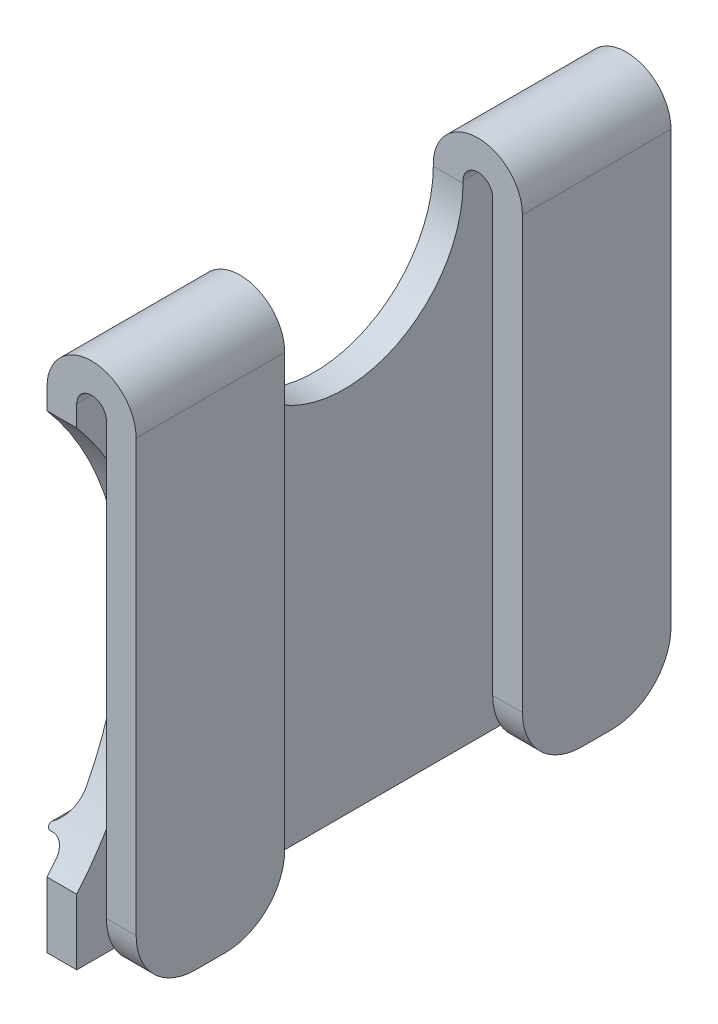
from build123d import *

# Parameters (mm, degrees)
SKETCH_1_W                      = 90
SKETCH_1_H                      = 90
EXTRUDE_1_DEPTH                 = 15
SKETCH_2_W                      = 5
SKETCH_2_H                      = 82.5
CUT_EXTRUDE_1_DEPTH             = 102.734949747
CUT_EXTRUDE_2_REACH             = 67.383
SKETCH_3_W                      = 40
SKETCH_3_H                      = 90
FILLET_1_R                      = 10
CUT_EXTRUDE_3_DEPTH             = 65.420493634
EXTRUDE_4_DEPTH                 = 15
EXTRUDE_4_DEPTH_BACK            = 15
SKETCH_7_R                      = 5
EXTRUDE_5_DEPTH                 = 45
EXTRUDE_5_DEPTH_BACK            = 45
CUT_EXTRUDE_4_REACH             = 67.383
CUT_EXTRUDE_4_DIRECTION_2_DEPTH = 15
FILLET_2_R                      = 0.5
FILLET_3_R                      = 2


with BuildPart() as part:
    # 草图1 → 凸台-拉伸1 (new body)
    with BuildSketch(Plane(origin=(0, 0, 0), x_dir=(0, 0, -1), z_dir=(1, 0, 0))):
        Rectangle(SKETCH_1_W, SKETCH_1_H)
    extrude(amount=EXTRUDE_1_DEPTH)

    # 草图2 → 切除-拉伸1 (cut, through all)
    with BuildSketch(Plane.XY.offset(45)):
        with BuildLine():
            Line((0, 45), (0, 37.5))
            ThreePointArc((0, 37.5), (2.196699141, 42.803300859), (7.5, 45))
            Line((7.5, 45), (0, 45))
        make_face()
        with BuildLine():
            Line((15, 45), (7.5, 45))
            ThreePointArc((7.5, 45), (12.803300859, 42.803300859), (15, 37.5))
            Line((15, 37.5), (15, 45))
        make_face()
        with BuildLine():
            ThreePointArc((10, 37.5), (7.5, 40), (5, 37.5))
            Line((5, 37.5), (10, 37.5))
        make_face()
        with Locations((7.5, -3.75)):
            Rectangle(SKETCH_2_W, SKETCH_2_H)
    extrude(amount=-CUT_EXTRUDE_1_DEPTH, mode=Mode.SUBTRACT)

    # 切除-拉伸2: up to this face of the body (flat: up to its plane)
    cut_extrude_2_end = Plane(part.part.faces().sort_by_distance((5, -3.75, 0))[0])
    # 草图3 → 切除-拉伸2 (cut, up to the picked face)
    with BuildSketch(Plane(origin=(15, 0, 0), x_dir=(0, 0, -1), z_dir=(1, 0, 0)), mode=Mode.PRIVATE) as cut_extrude_2_sk1:
        Rectangle(SKETCH_3_W, SKETCH_3_H)
    cut_extrude_2_tool1 = split(extrude(cut_extrude_2_sk1.sketch, amount=-CUT_EXTRUDE_2_REACH, mode=Mode.PRIVATE), bisect_by=cut_extrude_2_end, keep=Keep.BOTH, mode=Mode.PRIVATE)
    add(cut_extrude_2_tool1.solids().sort_by(Axis((15, 0, 0), (-1, 0, 0)))[0], mode=Mode.SUBTRACT)

    # 圆角1
    fillet_1_edges = [part.edges().sort_by_distance(p)[0] for p in [
        (12.5, -45, 20),
        (12.5, -45, -20),
        (12.5, -45, -45),
        (12.5, -45, 45),
    ]]
    fillet(fillet_1_edges, radius=FILLET_1_R)

    # 草图4 → 切除-拉伸3 (cut, through all)
    with BuildSketch(Plane(origin=(5, 0, 0), x_dir=(0, 0, -1), z_dir=(1, 0, 0))):
        with BuildLine():
            Line((-20, 44.571067812), (-20, 37.104465858))
            ThreePointArc((-20, 37.104465858), (0, 17.104465858), (20, 37.104465858))
            Line((20, 37.104465858), (20, 44.571067812))
            Line((20, 44.571067812), (-20, 44.571067812))
        make_face()
    extrude(amount=-CUT_EXTRUDE_3_DEPTH, mode=Mode.SUBTRACT)

    # 草图7 → 凸台-拉伸4 (add, two sides: drawn at the far end of the back side and taken through both)
    with BuildSketch(Plane.XY.offset(-EXTRUDE_4_DEPTH_BACK)):
        with BuildLine():
            Line((0, -30), (-6, -30))
            ThreePointArc((-6, -30), (-13.5, -37.5), (-6, -45))
            Line((-6, -45), (0, -45))
            Line((0, -45), (0, -30))
        make_face()
        with Locations((-6, -37.5)):
            Circle(SKETCH_7_R, mode=Mode.SUBTRACT)
    extrude(amount=EXTRUDE_4_DEPTH + EXTRUDE_4_DEPTH_BACK)

    # 草图9 → 凸台-拉伸5 (add, two sides: drawn at the far end of the back side and taken through both)
    with BuildSketch(Plane.XY.offset(-EXTRUDE_5_DEPTH_BACK)):
        with BuildLine():
            Line((0, -24), (0, -30))
            Line((0, -30), (-6, -30))
            ThreePointArc((-6, -30), (-1.757359313, -28.242640687), (0, -24))
        make_face()
    extrude(amount=EXTRUDE_5_DEPTH + EXTRUDE_5_DEPTH_BACK)

    # 切除-拉伸4: up to this face of the body (flat: up to its plane)
    cut_extrude_4_end = Plane(part.part.faces().sort_by_distance((10, -2.920820113, 32.5))[0])
    # 草图6 → 切除-拉伸4 (cut, up to the picked face)
    with BuildSketch(Plane.ZY, mode=Mode.PRIVATE) as cut_extrude_4_sk1:
        with BuildLine():
            Line((45, 33.969795549), (45, -33.969795549))
            ThreePointArc((45, -33.969795549), (32.5, 0), (45, 33.969795549))
        make_face()
    cut_extrude_4_tool1 = split(extrude(cut_extrude_4_sk1.sketch, amount=-CUT_EXTRUDE_4_REACH, mode=Mode.PRIVATE), bisect_by=cut_extrude_4_end, keep=Keep.BOTH, mode=Mode.PRIVATE)
    # 草图6 → 切除-拉伸4 (cut, up to the picked face)
    with BuildSketch(Plane.ZY, mode=Mode.PRIVATE) as cut_extrude_4_sk2:
        with BuildLine():
            Line((-45, 33.969795549), (-45, -33.969795549))
            ThreePointArc((-45, -33.969795549), (-32.5, 0), (-45, 33.969795549))
        make_face()
    cut_extrude_4_tool2 = split(extrude(cut_extrude_4_sk2.sketch, amount=-CUT_EXTRUDE_4_REACH, mode=Mode.PRIVATE), bisect_by=cut_extrude_4_end, keep=Keep.BOTH, mode=Mode.PRIVATE)
    add(cut_extrude_4_tool1.solids().sort_by(Axis((0, 0, 39.945085), (1, 0, 0)))[0], mode=Mode.SUBTRACT)
    add(cut_extrude_4_tool2.solids().sort_by(Axis((0, 0, -39.945085), (1, 0, 0)))[0], mode=Mode.SUBTRACT)

    # 草图6 → 切除-拉伸4 direction 2 (cut)
    with BuildSketch(Plane.ZY):
        with BuildLine():
            Line((45, 33.969795549), (45, -33.969795549))
            ThreePointArc((45, -33.969795549), (32.5, 0), (45, 33.969795549))
        make_face()
        with BuildLine():
            Line((-45, 33.969795549), (-45, -33.969795549))
            ThreePointArc((-45, -33.969795549), (-32.5, 0), (-45, 33.969795549))
        make_face()
    extrude(amount=CUT_EXTRUDE_4_DIRECTION_2_DEPTH, mode=Mode.SUBTRACT)

    # 圆角2
    fillet_2_edges = [part.edges().sort_by_distance(p)[0] for p in [
        (-6, -30, -28.467980088),
        (-6, -30, 28.467980088),
    ]]
    fillet(fillet_2_edges, radius=FILLET_2_R)

    # 圆角3
    fillet_3_edges = [part.edges().sort_by_distance(p)[0] for p in [
        (0, -30, 28.467980088),
        (0, -30, -28.467980088),
    ]]
    fillet(fillet_3_edges, radius=FILLET_3_R)


solid = part.part
